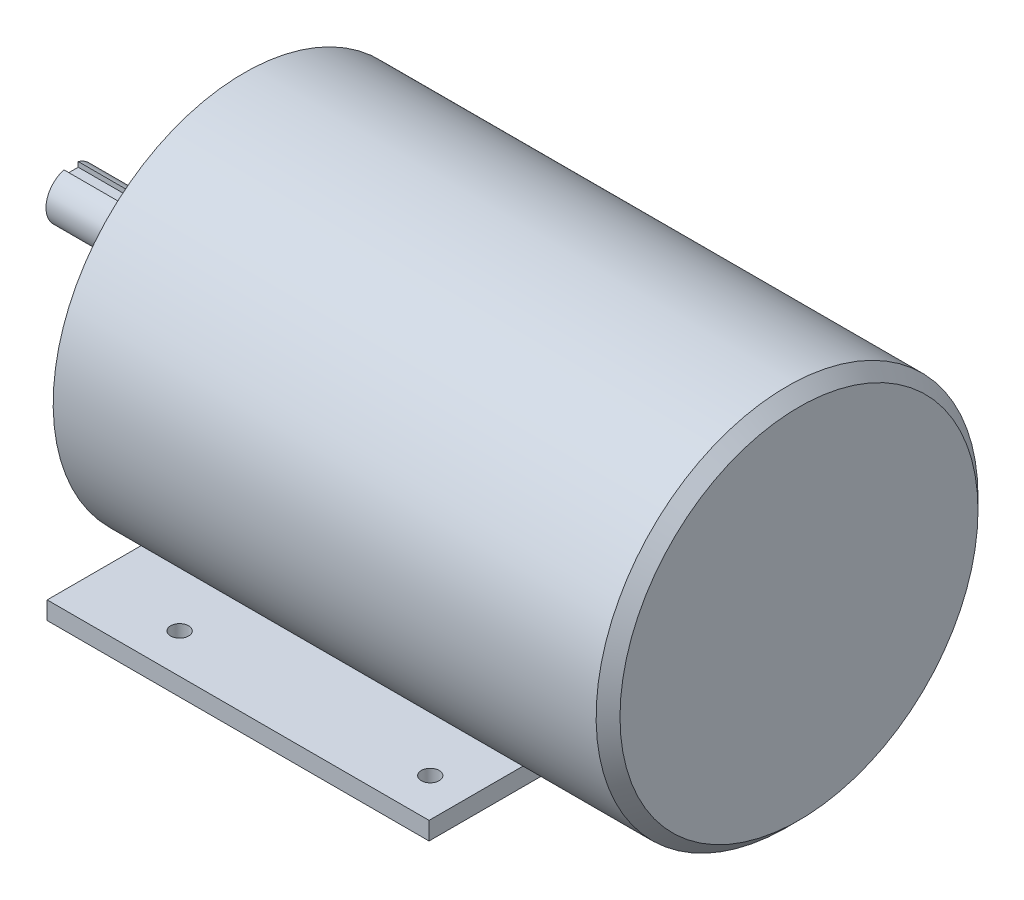
from build123d import *

# Parameters (mm, degrees)
SKETCH1_R           = 21
BOSS_EXTRUDE1_DEPTH = 110
SKETCH2_R           = 160
BOSS_EXTRUDE2_DEPTH = 500
SKETCH3_W           = 320
SKETCH3_H           = 320
BOSS_EXTRUDE3_DEPTH = 15
SKETCH4_R           = 7.5
CUT_EXTRUDE1_DEPTH  = 15
CHAMFER1_SIZE       = 10
CUT_EXTRUDE2_DEPTH  = 5
SKETCH7_R           = 6
CUT_EXTRUDE3_DEPTH  = 50


with BuildPart() as part:
    # Sketch1 → Boss-Extrude1 (new body)
    with BuildSketch(Plane(origin=(0, 0, 0), x_dir=(0, 0, -1), z_dir=(1, 0, 0))):
        Circle(SKETCH1_R)
    extrude(amount=BOSS_EXTRUDE1_DEPTH)

    # Sketch2 → Boss-Extrude2 (add)
    with BuildSketch(Plane(origin=(110, 0, 0), x_dir=(0, 0, -1), z_dir=(1, 0, 0))):
        Circle(SKETCH2_R)
    extrude(amount=BOSS_EXTRUDE2_DEPTH)

    # Sketch3 → Boss-Extrude3 (add)
    with BuildSketch(Plane(origin=(0, -160, 0), x_dir=(1, 0, 0), z_dir=(0, 1, 0))):
        with Locations((300, 0)):
            Rectangle(SKETCH3_W, SKETCH3_H)
    extrude(amount=BOSS_EXTRUDE3_DEPTH)

    # Sketch4 → Cut-Extrude1 (cut)
    with BuildSketch(Plane.XZ.offset(160)):
        with Locations(Location((428, 127, 0), (0, 0, 270))):
            Circle(SKETCH4_R)
        with Locations(Location((218, 127, 0), (0, 0, 270))):
            Circle(SKETCH4_R)
        with Locations(Location((218, -127, 0), (0, 0, 270))):
            Circle(SKETCH4_R)
        with Locations(Location((428, -127, 0), (0, 0, 270))):
            Circle(SKETCH4_R)
    extrude(amount=-CUT_EXTRUDE1_DEPTH, mode=Mode.SUBTRACT)

    # Chamfer1
    chamfer1_edges = [part.edges().sort_by_distance(p)[0] for p in [
        (110, 0, 160),
        (610, 0, 160),
    ]]
    chamfer(chamfer1_edges, length=CHAMFER1_SIZE)

    # Sketch5 → Cut-Revolve1 (revolve, cut)
    with BuildSketch(Plane.XY, mode=Mode.PRIVATE) as cut_revolve1_sk:
        Polygon((145.021608212, 165.529428324), (110, 165.529428324), (110, 37.056137485), (115.568052014, 53.947048233), (126.316813399, 69.30242164), (136.897249661, 84.417330587), (136.897249661, 105.131626256), (145.021608212, 129.777196164), align=None)
    revolve(cut_revolve1_sk.sketch.rotate(Axis((0, 0, 0), (-1, 0, 0)), 90), axis=Axis((0, 0, 0), (-1, 0, 0)), mode=Mode.SUBTRACT)

    # Sketch6 → Cut-Extrude2 (cut)
    with BuildSketch(Plane(origin=(0, 21, 0), x_dir=(1, 0, 0), z_dir=(0, 1, 0))):
        with BuildLine():
            Line((104, 6), (0, 6))
            Line((0, 6), (0, -6))
            Line((0, -6), (104, -6))
            ThreePointArc((104, -6), (110, 0), (104, 6))
        make_face()
    extrude(amount=-CUT_EXTRUDE2_DEPTH, mode=Mode.SUBTRACT)

    # Sketch7 → Cut-Extrude3 (cut)
    with BuildSketch(Plane.ZY):
        Circle(SKETCH7_R)
    extrude(amount=-CUT_EXTRUDE3_DEPTH, mode=Mode.SUBTRACT)


solid = part.part
